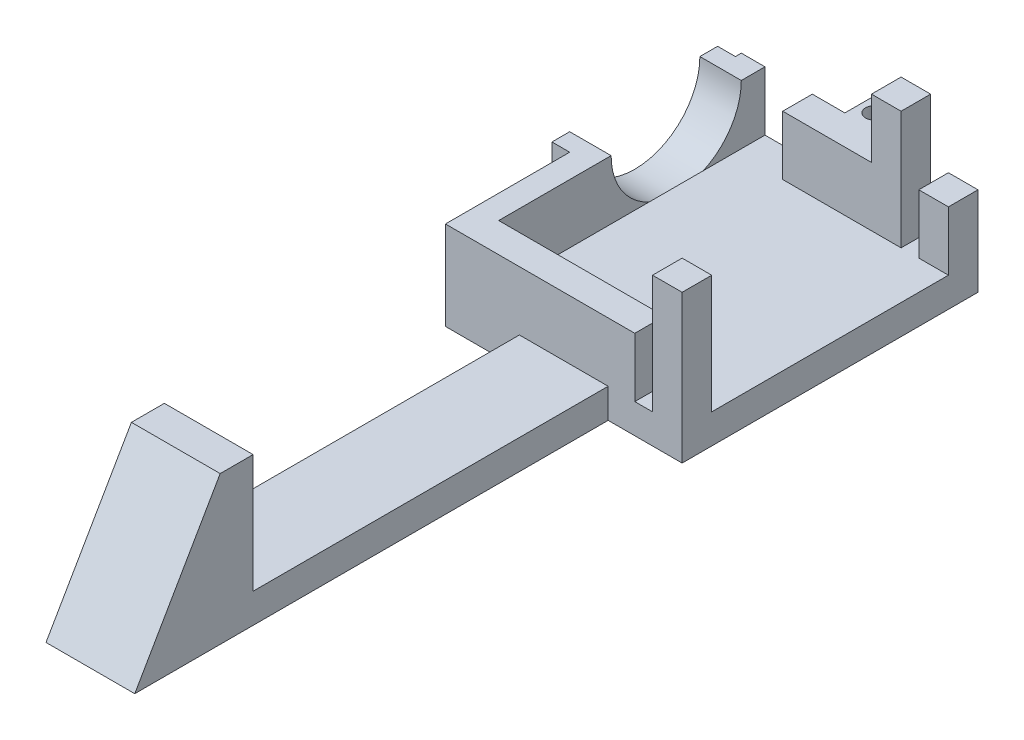
from build123d import *

# Parameters (mm, degrees)
SKETCH1_W            = 40
SKETCH1_H            = 50
BOSS_EXTRUDE1_DEPTH  = 5
SKETCH3_W            = 5
SKETCH3_H            = 5
BOSS_EXTRUDE5_DEPTH  = 20
SKETCH3_3_W          = 5
SKETCH3_3_H          = 5
SKETCH3_3_W_2        = 15
BOSS_EXTRUDE6_DEPTH  = 10
CUT_EXTRUDE3_DEPTH   = 4
BOSS_EXTRUDE9_START  = 3
BOSS_EXTRUDE9_DEPTH  = 3
SKETCH12_W           = 5
SKETCH12_H           = 5
BOSS_EXTRUDE10_DEPTH = 5
SKETCH13_R           = 1.5
CUT_EXTRUDE4_DEPTH   = 5
SKETCH14_W           = 15
SKETCH14_H           = 5
BOSS_EXTRUDE11_DEPTH = 80
SKETCH15_W           = 15
SKETCH15_H           = 20
BOSS_EXTRUDE13_DEPTH = 20
CUT_EXTRUDE7_DEPTH   = 15


with BuildPart() as part:
    # Sketch1 → Boss-Extrude1 (new body)
    with BuildSketch(Plane(origin=(0, 0, 0), x_dir=(1, 0, 0), z_dir=(0, 1, 0))):
        Rectangle(SKETCH1_W, SKETCH1_H)
    extrude(amount=BOSS_EXTRUDE1_DEPTH)

    # Sketch3 → Boss-Extrude5 (add)
    with BuildSketch(Plane(origin=(0, 5, 0), x_dir=(1, 0, 0), z_dir=(0, 1, 0))):
        with Locations((9.5, 22.5)):
            Rectangle(SKETCH3_W, SKETCH3_H)
        with Locations((17.5, -22.5)):
            Rectangle(SKETCH3_W, SKETCH3_H)
    extrude(amount=BOSS_EXTRUDE5_DEPTH)

    # Sketch3<3> → Boss-Extrude6 (add)
    with BuildSketch(Plane(origin=(0, 5, 0), x_dir=(1, 0, 0), z_dir=(0, 1, 0))):
        with Locations((17.5, 22.5)):
            Rectangle(SKETCH3_3_W, SKETCH3_3_H)
        with Locations((-0.5, 22.5)):
            Rectangle(SKETCH3_3_W_2, SKETCH3_3_H)
        Polygon((-16, -20), (-16, 25), (-20, 25), (-20, -25), (12, -25), (12, -20), align=None)
    extrude(amount=BOSS_EXTRUDE6_DEPTH)

    # Sketch8 → Cut-Extrude3 (cut)
    with BuildSketch(Plane.ZY.offset(20)):
        with BuildLine():
            Line((1, 15), (-21, 15))
            ThreePointArc((-21, 15), (-10, 4), (1, 15))
        make_face()
    extrude(amount=-CUT_EXTRUDE3_DEPTH, mode=Mode.SUBTRACT)

    # Sketch10 → Boss-Extrude9 (add)
    with BuildSketch(Plane.ZY.offset(20).offset(BOSS_EXTRUDE9_START)):
        with BuildLine():
            Line((1, 15), (4, 15))
            Line((4, 15), (4, 0))
            Line((4, 0), (-24, 0))
            Line((-24, 0), (-24, 15))
            Line((-24, 15), (-21, 15))
            ThreePointArc((-21, 15), (-10, 4), (1, 15))
        make_face()
    extrude(amount=-BOSS_EXTRUDE9_DEPTH)

    # Sketch12 → Boss-Extrude10 (add)
    with BuildSketch(Plane(origin=(0, 0, -25), x_dir=(-1, 0, 0), z_dir=(0, 0, -1))):
        with Locations((0, 12.5)):
            Rectangle(SKETCH12_W, SKETCH12_H)
    extrude(amount=BOSS_EXTRUDE10_DEPTH)

    # Sketch13 → Cut-Extrude4 (cut)
    with BuildSketch(Plane.XZ.offset(-10)):
        with Locations((0, -27.5)):
            Circle(SKETCH13_R)
    extrude(amount=-CUT_EXTRUDE4_DEPTH, mode=Mode.SUBTRACT)

    # Sketch14 → Boss-Extrude11 (add)
    with BuildSketch(Plane.XY.offset(25)):
        with Locations((0, 2.5)):
            Rectangle(SKETCH14_W, SKETCH14_H)
    extrude(amount=BOSS_EXTRUDE11_DEPTH)

    # Sketch15 → Boss-Extrude13 (add)
    with BuildSketch(Plane(origin=(0, 5, 0), x_dir=(1, 0, 0), z_dir=(0, 1, 0))):
        with Locations((0, -95)):
            Rectangle(SKETCH15_W, SKETCH15_H)
    extrude(amount=BOSS_EXTRUDE13_DEPTH)

    # Sketch18 → Cut-Extrude7 (cut)
    with BuildSketch(Plane.ZY.offset(7.5)):
        Polygon((105, 0), (90.56624327, 25), (105, 25), align=None)
    extrude(amount=-CUT_EXTRUDE7_DEPTH, mode=Mode.SUBTRACT)


solid = part.part
